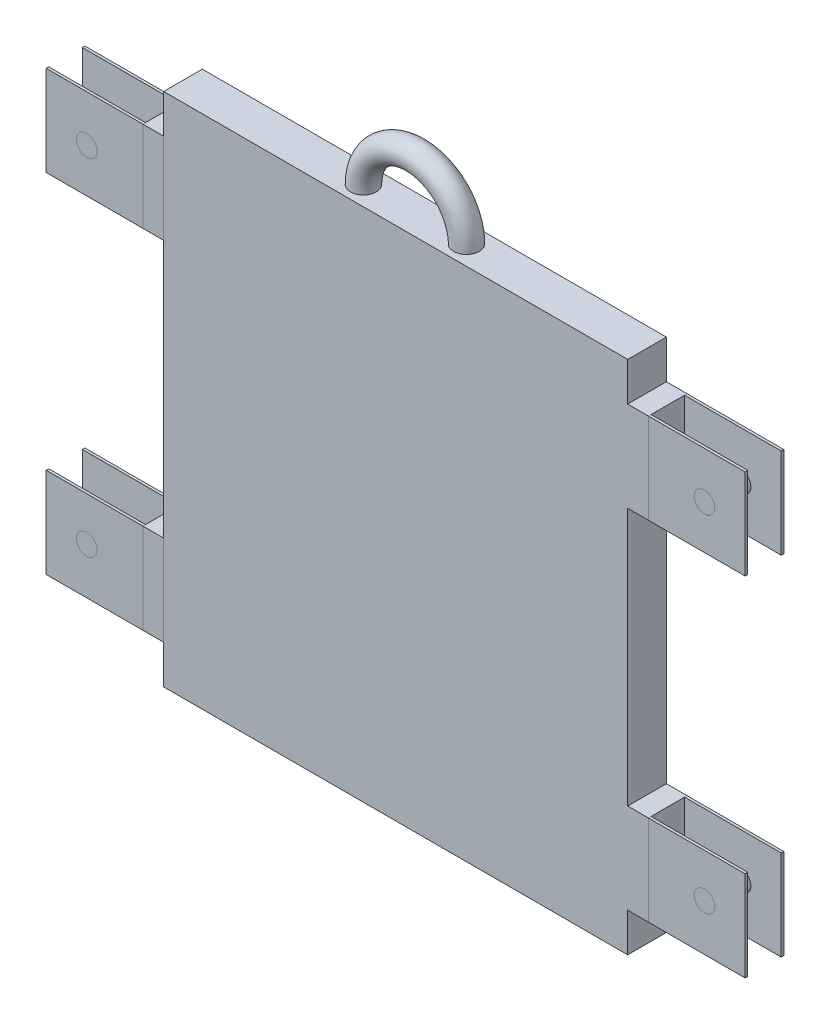
from build123d import *

# Parameters (mm, degrees)
SKETCH1_W             = 180
SKETCH1_H             = 200
BOSS_EXTRUDE1_DEPTH   = 15
SKETCH3_W             = 15
SKETCH3_H             = 35
BOSS_EXTRUDE2_DEPTH   = 8.04
BOSS_EXTRUDE2_2_DEPTH = 8.04
SKETCH4_W             = 1
SKETCH4_H             = 35
BOSS_EXTRUDE3_DEPTH   = 37.5
BOSS_EXTRUDE3_2_DEPTH = 37.5
BOSS_EXTRUDE3_3_DEPTH = 37.5
BOSS_EXTRUDE3_4_DEPTH = 37.5
SKETCH5_W             = 1
SKETCH5_H             = 35
BOSS_EXTRUDE4_DEPTH   = 37.5
BOSS_EXTRUDE4_2_DEPTH = 37.5
BOSS_EXTRUDE4_3_DEPTH = 37.5
BOSS_EXTRUDE4_4_DEPTH = 37.5
SKETCH6_R             = 4
CUT_EXTRUDE1_DEPTH    = 40
SKETCH7_R             = 4
BOSS_EXTRUDE5_DEPTH   = 15
BOSS_EXTRUDE5_2_DEPTH = 15
BOSS_EXTRUDE5_3_DEPTH = 15
BOSS_EXTRUDE5_4_DEPTH = 15
SKETCH8_R             = 5


with BuildPart() as part:
    # Sketch1 → Boss-Extrude1 (new body)
    with BuildSketch(Plane.XY):
        Rectangle(SKETCH1_W, SKETCH1_H)
    extrude(amount=BOSS_EXTRUDE1_DEPTH)


with BuildPart() as body_2:
    # Sketch3 → Boss-Extrude2 (new body)
    with BuildSketch(Plane.ZY.offset(90)):
        with Locations((7.5, 67.5)):
            Rectangle(SKETCH3_W, SKETCH3_H)
    boss_extrude2 = extrude(amount=BOSS_EXTRUDE2_DEPTH)


with BuildPart() as body_3:
    # Sketch3 → Boss-Extrude2 2 (new body)
    with BuildSketch(Plane.ZY.offset(90)):
        with Locations((7.5, -67.5)):
            Rectangle(SKETCH3_W, SKETCH3_H)
    boss_extrude2_2 = extrude(amount=BOSS_EXTRUDE2_2_DEPTH)


with BuildPart() as body_4:
    # Sketch4 → Boss-Extrude3 (new body)
    with BuildSketch(Plane.ZY.offset(98.04)):
        with Locations((0.5, 67.5)):
            Rectangle(SKETCH4_W, SKETCH4_H)
    extrude(amount=BOSS_EXTRUDE3_DEPTH)


with BuildPart() as body_5:
    # Sketch4 → Boss-Extrude3 2 (new body)
    with BuildSketch(Plane.ZY.offset(98.04)):
        with Locations((14.5, 67.5)):
            Rectangle(SKETCH4_W, SKETCH4_H)
    extrude(amount=BOSS_EXTRUDE3_2_DEPTH)


with BuildPart() as body_6:
    # Sketch4 → Boss-Extrude3 3 (new body)
    with BuildSketch(Plane.ZY.offset(98.04)):
        with Locations((14.5, -67.5)):
            Rectangle(SKETCH4_W, SKETCH4_H)
    extrude(amount=BOSS_EXTRUDE3_3_DEPTH)


with BuildPart() as body_7:
    # Sketch4 → Boss-Extrude3 4 (new body)
    with BuildSketch(Plane.ZY.offset(98.04)):
        with Locations((0.5, -67.5)):
            Rectangle(SKETCH4_W, SKETCH4_H)
    extrude(amount=BOSS_EXTRUDE3_4_DEPTH)


with BuildPart() as part_1:
    add(part.part)

    # Mirror6: Boss-Extrude2, Boss-Extrude2 2 across plane
    add(boss_extrude2.mirror(Plane(origin=(0, 0, 0), x_dir=(0, 0, 1), z_dir=(1, 0, 0))))
    add(boss_extrude2_2.mirror(Plane(origin=(0, 0, 0), x_dir=(0, 0, 1), z_dir=(1, 0, 0))))


with BuildPart() as body_8:
    # Sketch5 → Boss-Extrude4 (new body)
    with BuildSketch(Plane(origin=(98.04, 0, 0), x_dir=(0, 0, -1), z_dir=(1, 0, 0))):
        with Locations((-14.5, 67.5)):
            Rectangle(SKETCH5_W, SKETCH5_H)
    extrude(amount=BOSS_EXTRUDE4_DEPTH)


with BuildPart() as body_9:
    # Sketch5 → Boss-Extrude4 2 (new body)
    with BuildSketch(Plane(origin=(98.04, 0, 0), x_dir=(0, 0, -1), z_dir=(1, 0, 0))):
        with Locations((-0.5, 67.5)):
            Rectangle(SKETCH5_W, SKETCH5_H)
    extrude(amount=BOSS_EXTRUDE4_2_DEPTH)


with BuildPart() as body_10:
    # Sketch5 → Boss-Extrude4 3 (new body)
    with BuildSketch(Plane(origin=(98.04, 0, 0), x_dir=(0, 0, -1), z_dir=(1, 0, 0))):
        with Locations((-0.5, -67.5)):
            Rectangle(SKETCH5_W, SKETCH5_H)
    extrude(amount=BOSS_EXTRUDE4_3_DEPTH)


with BuildPart() as body_11:
    # Sketch5 → Boss-Extrude4 4 (new body)
    with BuildSketch(Plane(origin=(98.04, 0, 0), x_dir=(0, 0, -1), z_dir=(1, 0, 0))):
        with Locations((-14.5, -67.5)):
            Rectangle(SKETCH5_W, SKETCH5_H)
    extrude(amount=BOSS_EXTRUDE4_4_DEPTH)


with BuildPart() as cut_extrude1_tool:
    # Sketch6 → Cut-Extrude1 (new body)
    with BuildSketch(Plane.XY.offset(15)):
        with Locations((-119.79, -67)):
            Circle(SKETCH6_R)
        with Locations((119.79, -67)):
            Circle(SKETCH6_R)
        with Locations((119.79, 67)):
            Circle(SKETCH6_R)
        with Locations((-119.79, 67)):
            Circle(SKETCH6_R)
    extrude(amount=-CUT_EXTRUDE1_DEPTH)


with BuildPart() as body_4_1:
    add(body_4.part)

    # Cut-Extrude1: cut by cut_extrude1_tool
    add(cut_extrude1_tool.part, mode=Mode.SUBTRACT)


with BuildPart() as body_5_1:
    add(body_5.part)

    # Cut-Extrude1: cut by cut_extrude1_tool
    add(cut_extrude1_tool.part, mode=Mode.SUBTRACT)


with BuildPart() as body_6_1:
    add(body_6.part)

    # Cut-Extrude1: cut by cut_extrude1_tool
    add(cut_extrude1_tool.part, mode=Mode.SUBTRACT)


with BuildPart() as body_7_1:
    add(body_7.part)

    # Cut-Extrude1: cut by cut_extrude1_tool
    add(cut_extrude1_tool.part, mode=Mode.SUBTRACT)


with BuildPart() as body_8_1:
    add(body_8.part)

    # Cut-Extrude1: cut by cut_extrude1_tool
    add(cut_extrude1_tool.part, mode=Mode.SUBTRACT)


with BuildPart() as body_9_1:
    add(body_9.part)

    # Cut-Extrude1: cut by cut_extrude1_tool
    add(cut_extrude1_tool.part, mode=Mode.SUBTRACT)


with BuildPart() as body_10_1:
    add(body_10.part)

    # Cut-Extrude1: cut by cut_extrude1_tool
    add(cut_extrude1_tool.part, mode=Mode.SUBTRACT)


with BuildPart() as body_11_1:
    add(body_11.part)

    # Cut-Extrude1: cut by cut_extrude1_tool
    add(cut_extrude1_tool.part, mode=Mode.SUBTRACT)


with BuildPart() as body_12:
    # Sketch7 → Boss-Extrude5 (new body)
    with BuildSketch(Plane.XY.offset(15)):
        with Locations((-119.79, 67)):
            Circle(SKETCH7_R)
    extrude(amount=-BOSS_EXTRUDE5_DEPTH)


with BuildPart() as body_13:
    # Sketch7 → Boss-Extrude5 2 (new body)
    with BuildSketch(Plane.XY.offset(15)):
        with Locations(Location((119.79, 67, 0), (0, 0, 180))):
            Circle(SKETCH7_R)
    extrude(amount=-BOSS_EXTRUDE5_2_DEPTH)


with BuildPart() as body_14:
    # Sketch7 → Boss-Extrude5 3 (new body)
    with BuildSketch(Plane.XY.offset(15)):
        with Locations((119.79, -67)):
            Circle(SKETCH7_R)
    extrude(amount=-BOSS_EXTRUDE5_3_DEPTH)


with BuildPart() as body_15:
    # Sketch7 → Boss-Extrude5 4 (new body)
    with BuildSketch(Plane.XY.offset(15)):
        with Locations(Location((-119.79, -67, 0), (0, 0, 180))):
            Circle(SKETCH7_R)
    extrude(amount=-BOSS_EXTRUDE5_4_DEPTH)


with BuildPart() as body_16:
    # Sketch8 → Revolve1 (revolve)
    with BuildSketch(Plane(origin=(0, 100, 0), x_dir=(1, 0, 0), z_dir=(0, 1, 0))):
        with Locations((-20, -7.5)):
            Circle(SKETCH8_R)
    revolve(axis=Axis((0, 100, -60.652387997), (0, 0, 1)))


solid = Compound([body_2.part, body_3.part, part_1.part, body_4_1.part, body_5_1.part, body_6_1.part, body_7_1.part, body_8_1.part, body_9_1.part, body_10_1.part, body_11_1.part, body_12.part, body_13.part, body_14.part, body_15.part, body_16.part])
